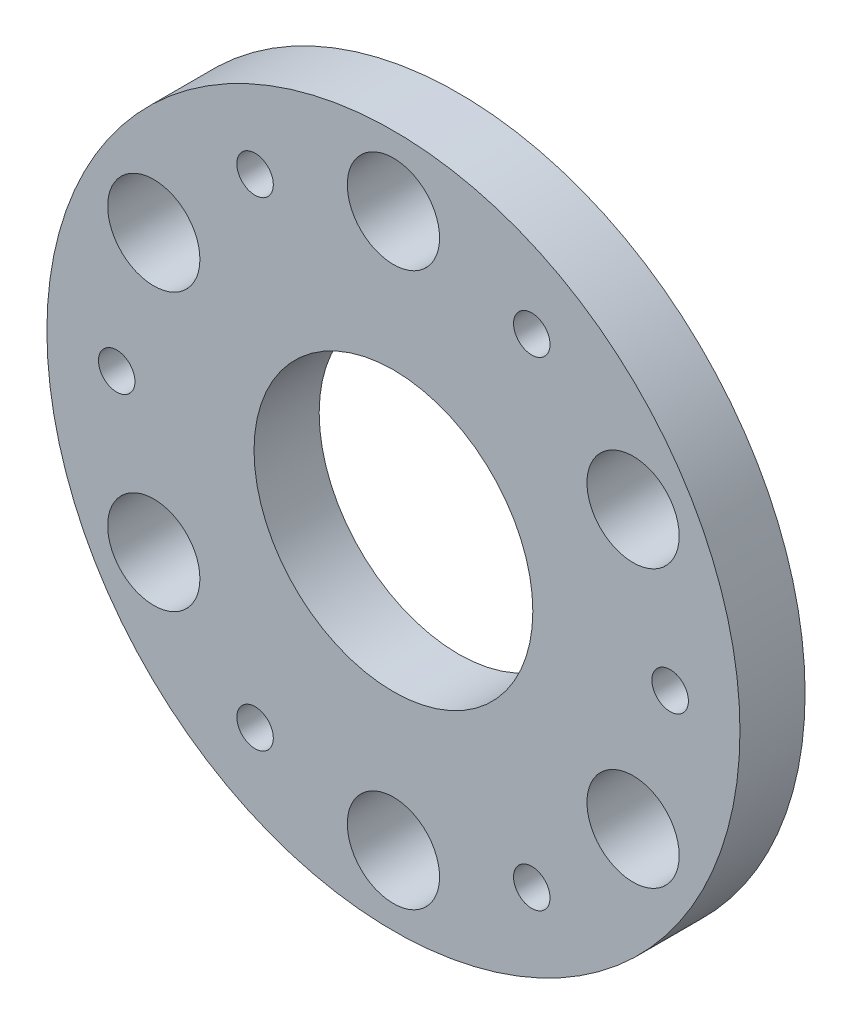
from build123d import *

# Parameters (mm, degrees)
SKETCH1_R                 = 16.891
SKETCH1_R_2               = 2.2479
BOSS_EXTRUDE1_DEPTH       = 3.175
TAP_DRILL_FOR_4_40_TAP1_D = 13.589
TAP_DRILL_FOR_2_56_TAP1_D = 1.778
CIRPATTERN1_COUNT         = 6


with BuildPart() as part:
    # Sketch1 → Boss-Extrude1 (new body)
    with BuildSketch(Plane.XY):
        Circle(SKETCH1_R)
        with Locations((0, -13.4874)):
            Circle(SKETCH1_R_2, mode=Mode.SUBTRACT)
        with Locations((-11.680431031, -6.7437)):
            Circle(SKETCH1_R_2, mode=Mode.SUBTRACT)
        with Locations((-11.680431031, 6.7437)):
            Circle(SKETCH1_R_2, mode=Mode.SUBTRACT)
        with Locations((0, 13.4874)):
            Circle(SKETCH1_R_2, mode=Mode.SUBTRACT)
        with Locations((11.680431031, 6.7437)):
            Circle(SKETCH1_R_2, mode=Mode.SUBTRACT)
        with Locations((11.680431031, -6.7437)):
            Circle(SKETCH1_R_2, mode=Mode.SUBTRACT)
    extrude(amount=BOSS_EXTRUDE1_DEPTH)

    # Tap Drill for #4-40 Tap1 (through all)
    with Locations(Plane.XY.offset(3.175)):
        with Locations((0, 0)):
            Hole(TAP_DRILL_FOR_4_40_TAP1_D / 2)

    # Tap Drill for #2-56 Tap1 (through all)
    with Locations(Plane.XY.offset(3.175)):
        with Locations((13.4874, 0)):
            tap_drill_for_2_56_tap1 = Hole(TAP_DRILL_FOR_2_56_TAP1_D / 2)

    # CirPattern1: Tap Drill for #2-56 Tap1 ×6 about axis
    cirpattern1_axis = Axis((0, 0, 0), (0, 0, 1))
    for i in range(1, CIRPATTERN1_COUNT):
        add(tap_drill_for_2_56_tap1.rotate(cirpattern1_axis, i * 360 / CIRPATTERN1_COUNT), mode=Mode.SUBTRACT)


solid = part.part
